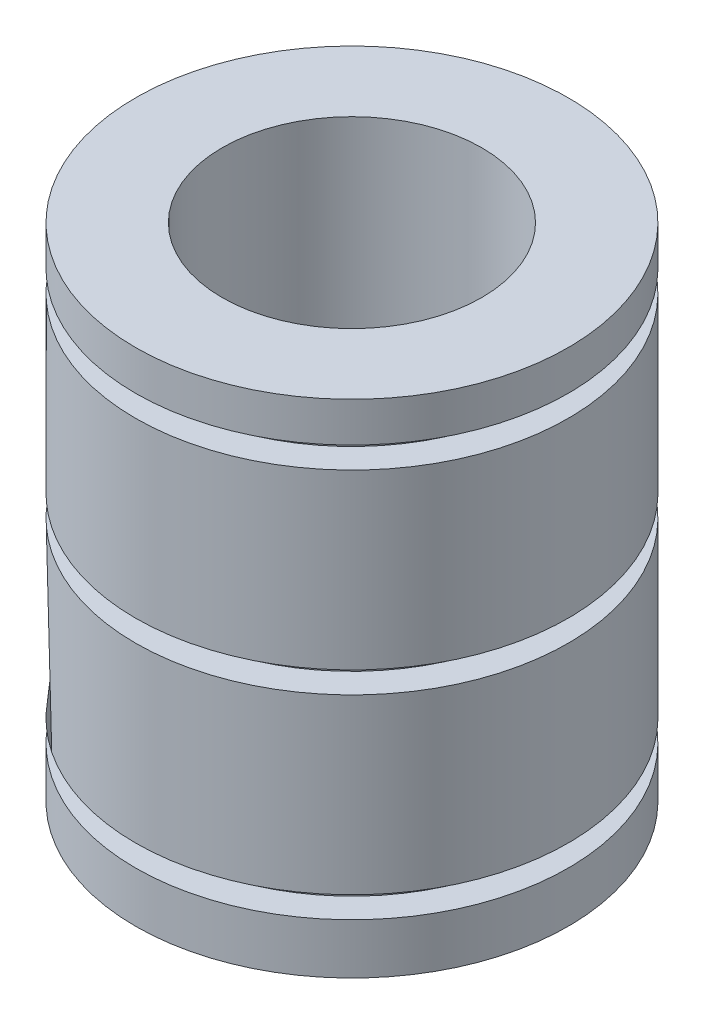
from build123d import *

# Parameters (mm, degrees)
SKETCH1_R               = 15
BOSS_EXTRUDE1_DEPTH     = 3.5
SKETCH3_R               = 13
BOSS_EXTRUDE2_DEPTH     = 1.5
SKETCH4_R               = 15
BOSS_EXTRUDE3_DEPTH     = 12
SKETCH5_R               = 13
BOSS_EXTRUDE4_DEPTH     = 1.5
SKETCH6_R               = 15
BOSS_EXTRUDE5_DEPTH     = 12
SKETCH7_R               = 13
BOSS_EXTRUDE6_DEPTH     = 1.5
SKETCH8_R               = 15
BOSS_EXTRUDE7_DEPTH     = 2.75
CUT_EXTRUDE1_DEPTH      = 41.713173544
CUT_EXTRUDE1_DEPTH_BACK = 41.713173544
SKETCH9_R               = 9
SKETCH12_R              = 9
BOSS_EXTRUDE9_DEPTH     = 2
CUT_EXTRUDE3_DEPTH      = 37.538507085
CUT_EXTRUDE3_DEPTH_BACK = 37.538507085
SKETCH13_R              = 1.5
SKETCH14_W              = 5
SKETCH14_H              = 34.75
BOSS_EXTRUDE10_DEPTH    = 1
CUT_EXTRUDE4_DEPTH      = 41.713173544
CUT_EXTRUDE4_DEPTH_BACK = 41.713173544
SKETCH15_R              = 15.408664216
SKETCH15_R_2            = 15


with BuildPart() as part:
    # Sketch1 → Boss-Extrude1 (new body)
    with BuildSketch(Plane(origin=(0, 0, 0), x_dir=(1, 0, 0), z_dir=(0, 1, 0))):
        with Locations(Location((0, 0, 0), (0, 0, 270))):
            Circle(SKETCH1_R)
    extrude(amount=BOSS_EXTRUDE1_DEPTH)

    # Sketch3 → Boss-Extrude2 (add)
    with BuildSketch(Plane(origin=(0, 3.5, 0), x_dir=(1, 0, 0), z_dir=(0, 1, 0))):
        with Locations(Location((0, 0, 0), (0, 0, 270))):
            Circle(SKETCH3_R)
    extrude(amount=BOSS_EXTRUDE2_DEPTH)

    # Sketch4 → Boss-Extrude3 (add)
    with BuildSketch(Plane(origin=(0, 5, 0), x_dir=(1, 0, 0), z_dir=(0, 1, 0))):
        with Locations(Location((0, 0, 0), (0, 0, 270))):
            Circle(SKETCH4_R)
    extrude(amount=BOSS_EXTRUDE3_DEPTH)

    # Sketch5 → Boss-Extrude4 (add)
    with BuildSketch(Plane(origin=(0, 17, 0), x_dir=(1, 0, 0), z_dir=(0, 1, 0))):
        with Locations(Location((0, 0, 0), (0, 0, 270))):
            Circle(SKETCH5_R)
    extrude(amount=BOSS_EXTRUDE4_DEPTH)

    # Sketch6 → Boss-Extrude5 (add)
    with BuildSketch(Plane(origin=(0, 18.5, 0), x_dir=(1, 0, 0), z_dir=(0, 1, 0))):
        with Locations(Location((0, 0, 0), (0, 0, 270))):
            Circle(SKETCH6_R)
    extrude(amount=BOSS_EXTRUDE5_DEPTH)

    # Sketch7 → Boss-Extrude6 (add)
    with BuildSketch(Plane(origin=(0, 30.5, 0), x_dir=(1, 0, 0), z_dir=(0, 1, 0))):
        with Locations(Location((0, 0, 0), (0, 0, 270))):
            Circle(SKETCH7_R)
    extrude(amount=BOSS_EXTRUDE6_DEPTH)

    # Sketch8 → Boss-Extrude7 (add)
    with BuildSketch(Plane(origin=(0, 32, 0), x_dir=(1, 0, 0), z_dir=(0, 1, 0))):
        with Locations(Location((0, 0, 0), (0, 0, 270))):
            Circle(SKETCH8_R)
    extrude(amount=BOSS_EXTRUDE7_DEPTH)

    # Sketch9 → Cut-Extrude1 (cut, two sides: drawn at the far end of the back side and taken through both)
    with BuildSketch(Plane(origin=(0, 0, 0), x_dir=(1, 0, 0), z_dir=(0, 1, 0)).offset(-CUT_EXTRUDE1_DEPTH_BACK)):
        with Locations(Location((0, 0, 0), (0, 0, 270))):
            Circle(SKETCH9_R)
    extrude(amount=CUT_EXTRUDE1_DEPTH + CUT_EXTRUDE1_DEPTH_BACK, mode=Mode.SUBTRACT)

    # Sketch12 → Boss-Extrude9 (add)
    with BuildSketch(Plane(origin=(0, 5, 0), x_dir=(1, 0, 0), z_dir=(0, 1, 0))):
        with Locations(Location((0, 0, 0), (0, 0, 270))):
            Circle(SKETCH12_R)
    extrude(amount=BOSS_EXTRUDE9_DEPTH)

    # Sketch13 → Cut-Extrude3 (cut, two sides: drawn at the far end of the back side and taken through both)
    with BuildSketch(Plane(origin=(0, 5, 0), x_dir=(1, 0, 0), z_dir=(0, 1, 0)).offset(-CUT_EXTRUDE3_DEPTH_BACK)):
        with Locations(Location((0, 0, 0), (0, 0, 270))):
            Circle(SKETCH13_R)
        with Locations(Location((0, 7, 0), (0, 0, 270))):
            Circle(SKETCH13_R)
        with Locations(Location((0, -7, 0), (0, 0, 270))):
            Circle(SKETCH13_R)
        with Locations(Location((7, 0, 0), (0, 0, 270))):
            Circle(SKETCH13_R)
        with Locations(Location((-7, 0, 0), (0, 0, 270))):
            Circle(SKETCH13_R)
    extrude(amount=CUT_EXTRUDE3_DEPTH + CUT_EXTRUDE3_DEPTH_BACK, mode=Mode.SUBTRACT)

    # Sketch14 → Boss-Extrude10 (add)
    with BuildSketch(Plane(origin=(-15, 0, 0), x_dir=(0, 0, -1), z_dir=(1, 0, 0))):
        with Locations((0, 17.375)):
            Rectangle(SKETCH14_W, SKETCH14_H)
    extrude(amount=BOSS_EXTRUDE10_DEPTH)

    # Sketch15 → Cut-Extrude4 (cut, two sides: drawn at the far end of the back side and taken through both)
    with BuildSketch(Plane(origin=(0, 34.75, 0), x_dir=(1, 0, 0), z_dir=(0, 1, 0)).offset(-CUT_EXTRUDE4_DEPTH_BACK)):
        Circle(SKETCH15_R)
        with Locations(Location((0, 0, 0), (0, 0, 270))):
            Circle(SKETCH15_R_2, mode=Mode.SUBTRACT)
    extrude(amount=CUT_EXTRUDE4_DEPTH + CUT_EXTRUDE4_DEPTH_BACK, mode=Mode.SUBTRACT)


solid = part.part
